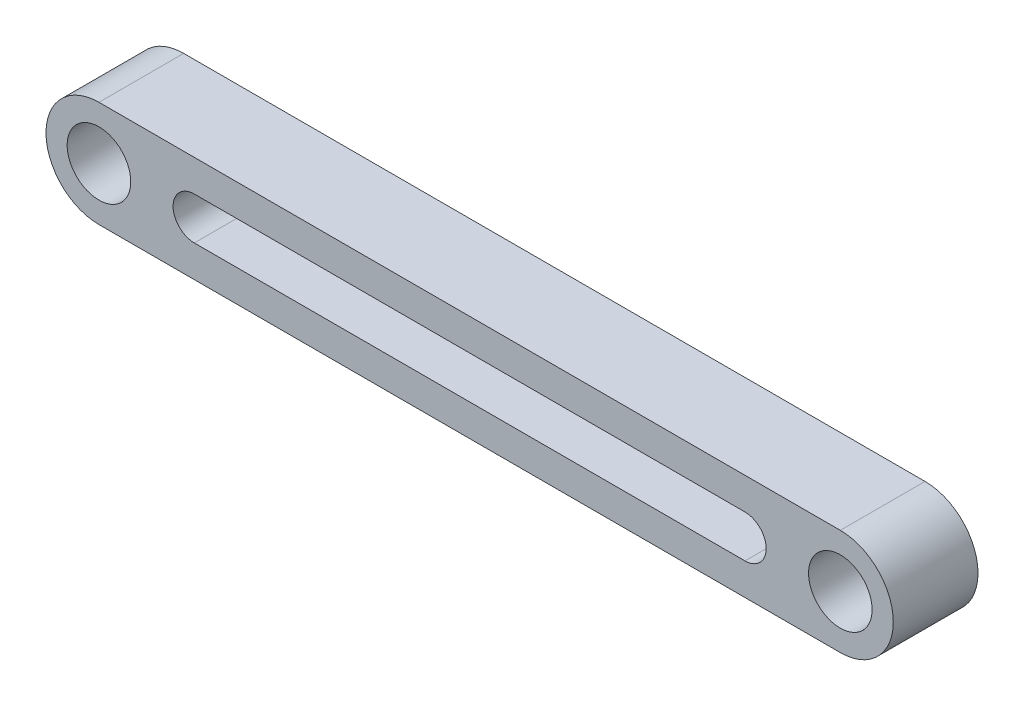
from build123d import *

# Parameters (mm, degrees)
ESQUISSE1_R        = 1.5
BOSS_EXTRU_1_DEPTH = 4


with BuildPart() as part:
    # Esquisse1 → Boss.-Extru.1 (new body)
    with BuildSketch(Plane.XY):
        with BuildLine():
            Line((0, 2.5), (35, 2.5))
            ThreePointArc((35, 2.5), (37.5, 0), (35, -2.5))
            Line((35, -2.5), (0, -2.5))
            ThreePointArc((0, -2.5), (-2.5, 0), (0, 2.5))
        make_face()
        Circle(ESQUISSE1_R, mode=Mode.SUBTRACT)
        with Locations((35, 0)):
            Circle(ESQUISSE1_R, mode=Mode.SUBTRACT)
        with BuildLine():
            Line((4.5, 1), (30.5, 1))
            ThreePointArc((30.5, 1), (31.5, 0), (30.5, -1))
            Line((30.5, -1), (4.5, -1))
            ThreePointArc((4.5, -1), (3.5, 0), (4.5, 1))
        make_face(mode=Mode.SUBTRACT)
    extrude(amount=BOSS_EXTRU_1_DEPTH)


solid = part.part
